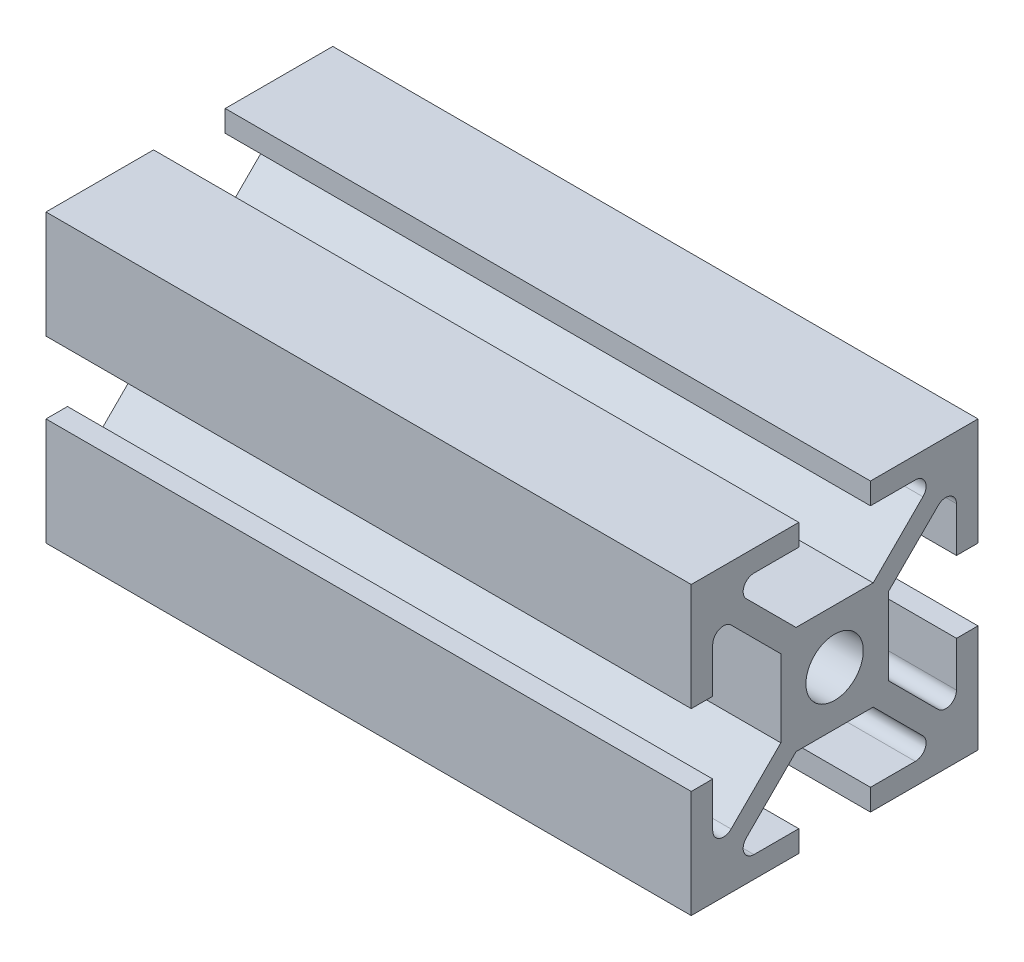
from build123d import *

# Parameters (mm, degrees)
ESQUISSE1_R        = 2
BOSS_EXTRU_1_DEPTH = 45
CONG_1_R           = 0.75


with BuildPart() as part:
    # Esquisse1 → Boss.-Extru.1 (new body)
    with BuildSketch(Plane(origin=(0, 0, 0), x_dir=(0, 0, -1), z_dir=(1, 0, 0))):
        Polygon((2.5, 10), (10, 10), (10, 2.5), (8.5, 2.5), (8.5, 7.439339828), (3.75, 2.689339828), (3.75, -2.689339828), (8.5, -7.439339828), (8.5, -2.5), (10, -2.5), (10, -10), (2.5, -10), (2.5, -8.5), (7.439339828, -8.5), (2.689339828, -3.75), (-2.689339828, -3.75), (-7.439339828, -8.5), (-2.5, -8.5), (-2.5, -10), (-10, -10), (-10, -2.5), (-8.5, -2.5), (-8.5, -7.439339828), (-3.75, -2.689339828), (-3.75, 2.689339828), (-8.5, 7.439339828), (-8.5, 2.5), (-10, 2.5), (-10, 10), (-2.5, 10), (-2.5, 8.5), (-7.439339828, 8.5), (-2.689339828, 3.75), (2.689339828, 3.75), (7.439339828, 8.5), (2.5, 8.5), align=None)
        with Locations(Location((0, 0, 0), (0, 0, 180))):
            Circle(ESQUISSE1_R, mode=Mode.SUBTRACT)
    extrude(amount=BOSS_EXTRU_1_DEPTH)

    # Congé1
    cong_1_edges = [part.edges().sort_by_distance(p)[0] for p in [
        (22.5, 7.439339828, -8.5),
        (22.5, -7.439339828, -8.5),
        (22.5, -8.5, -7.439339828),
        (22.5, -8.5, 7.439339828),
        (22.5, -7.439339828, 8.5),
        (22.5, 7.439339828, 8.5),
        (22.5, 8.5, 7.439339828),
        (22.5, 8.5, -7.439339828),
    ]]
    fillet(cong_1_edges, radius=CONG_1_R)


solid = part.part
